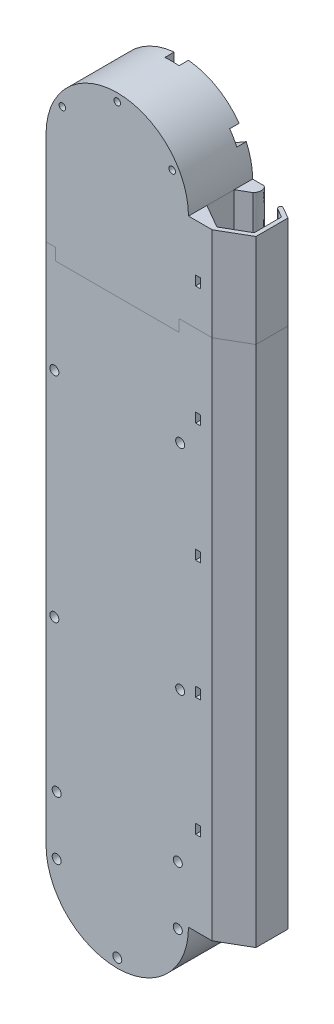
from build123d import *

# Parameters (mm, degrees)
BOSS_EXTRUDE1_DEPTH    = 25
CUT_EXTRUDE2_DEPTH     = 6
SKETCH5_R              = 1.9
SKETCH5_R_2            = 1.4
CUT_EXTRUDE4_DEPTH     = 165.405261473
CUT_EXTRUDE3_START     = -2
CUT_EXTRUDE3_DEPTH     = 4
SKETCH12_R             = 1.9
SKETCH12_R_2           = 1.4
BOSS_EXTRUDE2_DEPTH    = 2
BOSS_EXTRUDE3_START    = 129.7
BOSS_EXTRUDE3_DEPTH    = 259.4
CUT_EXTRUDE5_DEPTH     = 296.210345526
CUT_EXTRUDE6_REACH     = 172.003
SKETCH15_W             = 2
SKETCH15_H             = 4
SKETCH19_R             = 3
SKETCH19_W             = 6
SKETCH19_H             = 14.760042768
CUT_EXTRUDE9_DEPTH     = 4
CUT_EXTRUDE10_REACH    = 183.383
SKETCH20_R             = 1.5
SPLIT2_SURFACE_1_BACK  = 331.775
SPLIT2_SURFACE_1_DEPTH = 663.55
SPLIT2_SURFACE_2_BACK  = 331.775
SPLIT2_SURFACE_2_DEPTH = 663.55


with BuildPart() as part:
    # Sketch1 → Boss-Extrude1 (new body)
    with BuildSketch(Plane.XY):
        with BuildLine():
            Line((-30, -129.7), (-30, 129.7))
            ThreePointArc((-30, 129.7), (0, 159.7), (30, 129.7))
            Line((30, 129.7), (30, -129.7))
            ThreePointArc((30, -129.7), (0, -159.7), (-30, -129.7))
        make_face()
        with BuildLine():
            Line((-22, -129.7), (-22, 129.7))
            ThreePointArc((-22, 129.7), (0, 151.7), (22, 129.7))
            Line((22, 129.7), (22, -129.7))
            ThreePointArc((22, -129.7), (0, -151.7), (-22, -129.7))
        make_face(mode=Mode.SUBTRACT)
    extrude(amount=BOSS_EXTRUDE1_DEPTH)

    # Sketch9 → Cut-Extrude2 (cut)
    with BuildSketch(Plane.XY):
        Polygon((-21.390212729, -156.804138466), (-12.197628205, -143.163529172), (11.525170568, -143.163529172), (24.276174908, -155.914533512), (43.106146434, -137.084561987), (43.106146434, -85.339207165), (-47.337023886, -85.339207165), (-47.337023886, -133.377874679), align=None)
    extrude(amount=CUT_EXTRUDE2_DEPTH, mode=Mode.SUBTRACT)

    # Sketch5 → Cut-Extrude4 (cut, through all)
    with BuildSketch(Plane.XY):
        with Locations((0, -155.8)):
            Circle(SKETCH5_R)
        with Locations((26.5, -44.8)):
            Circle(SKETCH5_R)
        with Locations((26.5, 45.2)):
            Circle(SKETCH5_R)
        with Locations((-26.5, 45.2)):
            Circle(SKETCH5_R)
        with Locations((-26.5, -44.8)):
            Circle(SKETCH5_R)
        with Locations((0, 156.4)):
            Circle(SKETCH5_R_2)
        with Locations((-23.122878281, 143.05)):
            Circle(SKETCH5_R_2)
        with Locations((-23.122878281, 116.35)):
            Circle(SKETCH5_R_2)
        with Locations((23.122878281, 116.35)):
            Circle(SKETCH5_R_2)
        with Locations((25.5, -108.05)):
            Circle(SKETCH5_R)
        with Locations((25.5, -132.55)):
            Circle(SKETCH5_R)
        with Locations((-25.5, -132.55)):
            Circle(SKETCH5_R)
        with Locations((-25.5, -108.05)):
            Circle(SKETCH5_R)
        with Locations((23.122878281, 143.05)):
            Circle(SKETCH5_R_2)
    extrude(amount=CUT_EXTRUDE4_DEPTH, mode=Mode.SUBTRACT)

    # Sketch10 → Cut-Extrude3 (cut)
    with BuildSketch(Plane(origin=(0, 0, 0), x_dir=(-1, 0, 0), z_dir=(0, 0, -1)).offset(CUT_EXTRUDE3_START)):
        Polygon((-3.6, -157.878460969), (-3.6, -162.71716658), (3.6, -162.71716658), (3.6, -157.878460969), (3.6, -153.721539031), (0, -151.643078062), (-3.6, -153.721539031), align=None)
        Polygon((24.421539031, -48.4), (16.2024551, -53.14529032), (16.2024551, -37.249607228), (24.421539031, -41.2), (28.578460969, -41.2), (30.656921938, -44.8), (28.578460969, -48.4), align=None)
        Polygon((-30.656921938, -44.8), (-28.578460969, -48.4), (-24.421539031, -48.4), (-20.400603584, -51.424934988), (-19.526426192, -39.273869232), (-24.421539031, -41.2), (-28.578460969, -41.2), align=None)
        Polygon((-30.656921938, 45.2), (-28.578460969, 41.6), (-24.421539031, 41.6), (-19.065060642, 37.994104383), (-19.065060642, 53.102628113), (-24.421539031, 48.8), (-28.578460969, 48.8), align=None)
        Polygon((30.656921938, 45.2), (28.578460969, 48.8), (24.421539031, 48.8), (16.2024551, 49.307061606), (16.66355995, 39.520928689), (24.421539031, 41.6), (28.578460969, 41.6), align=None)
    extrude(amount=-CUT_EXTRUDE3_DEPTH, mode=Mode.SUBTRACT)

    # Sketch12 → Boss-Extrude2 (add)
    with BuildSketch(Plane.XY.offset(25)):
        with BuildLine():
            ThreePointArc((-30, -129.7), (0, -159.7), (30, -129.7))
            Line((30, -129.7), (30, 129.7))
            ThreePointArc((30, 129.7), (0, 159.7), (-30, 129.7))
            Line((-30, 129.7), (-30, -129.7))
        make_face()
        with Locations((-25.5, -132.55)):
            Circle(SKETCH12_R, mode=Mode.SUBTRACT)
        with Locations((-25.5, -108.05)):
            Circle(SKETCH12_R, mode=Mode.SUBTRACT)
        with Locations((-26.5, -44.8)):
            Circle(SKETCH12_R, mode=Mode.SUBTRACT)
        with Locations((0, -155.8)):
            Circle(SKETCH12_R, mode=Mode.SUBTRACT)
        with Locations((25.5, -132.55)):
            Circle(SKETCH12_R, mode=Mode.SUBTRACT)
        with Locations((25.5, -108.05)):
            Circle(SKETCH12_R, mode=Mode.SUBTRACT)
        with Locations(Location((26.5, -44.8, 0), (0, 0, 180))):
            Circle(SKETCH12_R, mode=Mode.SUBTRACT)
        with Locations(Location((-26.5, 45.2, 0), (0, 0, 180))):
            Circle(SKETCH12_R, mode=Mode.SUBTRACT)
        with Locations((-23.122878281, 143.05)):
            Circle(SKETCH12_R_2, mode=Mode.SUBTRACT)
        with Locations((0, 156.4)):
            Circle(SKETCH12_R_2, mode=Mode.SUBTRACT)
        with Locations((23.122878281, 143.05)):
            Circle(SKETCH12_R_2, mode=Mode.SUBTRACT)
        with Locations((26.5, 45.2)):
            Circle(SKETCH12_R, mode=Mode.SUBTRACT)
    extrude(amount=BOSS_EXTRUDE2_DEPTH)

    # Sketch13 → Boss-Extrude3 (add)
    with BuildSketch(Plane(origin=(0, 0, 0), x_dir=(1, 0, 0), z_dir=(0, 1, 0)).offset(BOSS_EXTRUDE3_START)):
        Polygon((30, -5.75), (39.959292144, 0), (30, 0), align=None)
        Polygon((51.650635095, -20.25), (51.650635095, -6.75), (39.959292144, 0), (30, -5.75), (30, -7.75), (39.959292144, -2), (49.918584287, -7.75), (49.918584287, -19.25), (39.959292144, -25), (30, -19.25), (30, -21.25), (39.959292144, -27), align=None)
        Polygon((30, -27), (39.959292144, -27), (30, -21.25), align=None)
    extrude(amount=-BOSS_EXTRUDE3_DEPTH)

    # Sketch14 → Cut-Extrude5 (cut, through all)
    with BuildSketch(Plane(origin=(0, 129.7, 0), x_dir=(1, 0, 0), z_dir=(0, 1, 0))):
        with BuildLine():
            Line((34.753614704, 0), (41.389978142, 4.813813584))
            Line((41.389978142, 4.813813584), (46.705528738, -3.894941514))
            add(Edge.make_bspline(
                [(46.219489402, -5.614326572), (45.136522269, -4.989075207), (45.751856574, -3.48025056), (46.705528738, -3.894941514)],
                knots=[0, 0, 0, 0, 1, 1, 1, 1], degree=3))
            Line((46.219489402, -5.614326572), (34.124720843, -5.368591311))
            add(Edge.make_bspline(
                [(34.124720843, -5.368591311), (36.321189715, -4.695693649), (36.745862601, -0.785774314), (34.753614704, 0)],
                knots=[0, 0, 0, 0, 1, 1, 1, 1], degree=3))
        make_face()
    extrude(amount=-CUT_EXTRUDE5_DEPTH, mode=Mode.SUBTRACT)

    # Cut-Extrude6: up to this plane
    cut_extrude6_end = Plane(origin=(-0.835494511, -129.7, 1.447118943), z_dir=(-0.5000000000000001, 0, 0.8660254037844386))
    # Sketch15 → Cut-Extrude6 (cut, up to the surface)
    with BuildSketch(Plane.XY.offset(27), mode=Mode.PRIVATE) as cut_extrude6_sk1:
        with Locations((33.996498591, 57.7)):
            Rectangle(SKETCH15_W, SKETCH15_H)
    cut_extrude6_tool1 = split(extrude(cut_extrude6_sk1.sketch, amount=-CUT_EXTRUDE6_REACH, mode=Mode.PRIVATE), bisect_by=cut_extrude6_end, keep=Keep.BOTH, mode=Mode.PRIVATE)
    add(cut_extrude6_tool1.solids().sort_by_distance((33.996499, 57.7, 27))[0], mode=Mode.SUBTRACT)
    # Sketch15 → Cut-Extrude6 (cut, up to the surface)
    with BuildSketch(Plane.XY.offset(27), mode=Mode.PRIVATE) as cut_extrude6_sk2:
        with Locations((33.996498591, 107.7)):
            Rectangle(SKETCH15_W, SKETCH15_H)
    cut_extrude6_tool2 = split(extrude(cut_extrude6_sk2.sketch, amount=-CUT_EXTRUDE6_REACH, mode=Mode.PRIVATE), bisect_by=cut_extrude6_end, keep=Keep.BOTH, mode=Mode.PRIVATE)
    add(cut_extrude6_tool2.solids().sort_by_distance((33.996499, 107.7, 27))[0], mode=Mode.SUBTRACT)
    # Sketch15 → Cut-Extrude6 (cut, up to the surface)
    with BuildSketch(Plane.XY.offset(27), mode=Mode.PRIVATE) as cut_extrude6_sk3:
        with Locations((33.996498591, 7.7)):
            Rectangle(SKETCH15_W, SKETCH15_H)
    cut_extrude6_tool3 = split(extrude(cut_extrude6_sk3.sketch, amount=-CUT_EXTRUDE6_REACH, mode=Mode.PRIVATE), bisect_by=cut_extrude6_end, keep=Keep.BOTH, mode=Mode.PRIVATE)
    add(cut_extrude6_tool3.solids().sort_by_distance((33.996499, 7.7, 27))[0], mode=Mode.SUBTRACT)
    # Sketch15 → Cut-Extrude6 (cut, up to the surface)
    with BuildSketch(Plane.XY.offset(27), mode=Mode.PRIVATE) as cut_extrude6_sk4:
        with Locations((33.996498591, -42.3)):
            Rectangle(SKETCH15_W, SKETCH15_H)
    cut_extrude6_tool4 = split(extrude(cut_extrude6_sk4.sketch, amount=-CUT_EXTRUDE6_REACH, mode=Mode.PRIVATE), bisect_by=cut_extrude6_end, keep=Keep.BOTH, mode=Mode.PRIVATE)
    add(cut_extrude6_tool4.solids().sort_by_distance((33.996499, -42.3, 27))[0], mode=Mode.SUBTRACT)
    # Sketch15 → Cut-Extrude6 (cut, up to the surface)
    with BuildSketch(Plane.XY.offset(27), mode=Mode.PRIVATE) as cut_extrude6_sk5:
        with Locations((33.996498591, -92.3)):
            Rectangle(SKETCH15_W, SKETCH15_H)
    cut_extrude6_tool5 = split(extrude(cut_extrude6_sk5.sketch, amount=-CUT_EXTRUDE6_REACH, mode=Mode.PRIVATE), bisect_by=cut_extrude6_end, keep=Keep.BOTH, mode=Mode.PRIVATE)
    add(cut_extrude6_tool5.solids().sort_by_distance((33.996499, -92.3, 27))[0], mode=Mode.SUBTRACT)

    # Sketch19 → Cut-Extrude9 (cut)
    with BuildSketch(Plane(origin=(0, 0, 0), x_dir=(-1, 0, 0), z_dir=(0, 0, -1))):
        with Locations((-23.122878281, 116.35)):
            Circle(SKETCH19_R)
        with Locations((23.122878281, 116.35)):
            Circle(SKETCH19_R)
        Polygon((18.231592282, 136.761913097), (31.01416428, 144.141934481), (28.01416428, 149.338086903), (15.231592282, 141.958065519), align=None)
        with Locations((0, 156.4)):
            Rectangle(SKETCH19_W, SKETCH19_H)
        Polygon((-15.231592282, 141.958065519), (-28.01416428, 149.338086903), (-31.01416428, 144.141934481), (-18.231592282, 136.761913097), align=None)
    extrude(amount=-CUT_EXTRUDE9_DEPTH, mode=Mode.SUBTRACT)

    # Cut-Extrude10: up to this face of the body (flat: up to its plane)
    cut_extrude10_end = Plane(part.part.faces().sort_by_distance((30, 0, 13.5))[0])
    # Sketch20 → Cut-Extrude10 (cut, up to the picked face)
    with BuildSketch(Plane.ZY.offset(30), mode=Mode.PRIVATE) as cut_extrude10_sk1:
        with Locations(Location((20.5, 87.8, 0), (0, 0, 213.557309762))):
            Circle(SKETCH20_R)
    cut_extrude10_tool1 = split(extrude(cut_extrude10_sk1.sketch, amount=-CUT_EXTRUDE10_REACH, mode=Mode.PRIVATE), bisect_by=cut_extrude10_end, keep=Keep.BOTH, mode=Mode.PRIVATE)
    # Sketch20 → Cut-Extrude10 (cut, up to the picked face)
    with BuildSketch(Plane.ZY.offset(30), mode=Mode.PRIVATE) as cut_extrude10_sk2:
        with Locations(Location((4.5, 87.8, 0), (0, 0, 270))):
            Circle(SKETCH20_R)
    cut_extrude10_tool2 = split(extrude(cut_extrude10_sk2.sketch, amount=-CUT_EXTRUDE10_REACH, mode=Mode.PRIVATE), bisect_by=cut_extrude10_end, keep=Keep.BOTH, mode=Mode.PRIVATE)
    add(cut_extrude10_tool1.solids().sort_by(Axis((-30, 87.8, 20.5), (1, 0, 0)))[0], mode=Mode.SUBTRACT)
    add(cut_extrude10_tool2.solids().sort_by(Axis((-30, 87.8, 4.5), (1, 0, 0)))[0], mode=Mode.SUBTRACT)


with BuildPart() as body_2:
    # Split2: the piece behind the surface
    add(part.part)
    # Split2 surface: a surface, the sketch's curves swept straight by 663.55 mm
    with BuildLine(Plane.XY.offset(27).offset(-SPLIT2_SURFACE_1_BACK), mode=Mode.PRIVATE) as split2_surface_1_path:
        Line((-56.581540955, 90.3), (-26, 90.3))
        Line((-26, 90.3), (-26, 85.3))
        Line((-26, 85.3), (-0.354937424, 85.3))
        Line((-0.354937424, 85.3), (26, 85.3))
        Line((26, 85.3), (26, 90.3))
        Line((26, 90.3), (80.735305882, 90.3))
        Line((80.735305882, 90.3), (80.735305882, 186.789410698))
        Line((80.735305882, 186.789410698), (-47.830309584, 186.789410698))
        Line((-47.830309584, 186.789410698), (-56.581540955, 90.3))
    split2_surface_1 = Shell.extrude(split2_surface_1_path.wire(), (0 * SPLIT2_SURFACE_1_DEPTH, 0 * SPLIT2_SURFACE_1_DEPTH, 1 * SPLIT2_SURFACE_1_DEPTH))
    split(bisect_by=split2_surface_1, keep=Keep.BOTTOM)


with BuildPart() as part_1:
    add(part.part)

    # Split2: split by a surface, the side it looks to stays
    # Split2 surface: a surface, the sketch's curves swept straight by 663.55 mm
    with BuildLine(Plane.XY.offset(27).offset(-SPLIT2_SURFACE_2_BACK), mode=Mode.PRIVATE) as split2_surface_2_path:
        Line((-56.581540955, 90.3), (-26, 90.3))
        Line((-26, 90.3), (-26, 85.3))
        Line((-26, 85.3), (-0.354937424, 85.3))
        Line((-0.354937424, 85.3), (26, 85.3))
        Line((26, 85.3), (26, 90.3))
        Line((26, 90.3), (80.735305882, 90.3))
        Line((80.735305882, 90.3), (80.735305882, 186.789410698))
        Line((80.735305882, 186.789410698), (-47.830309584, 186.789410698))
        Line((-47.830309584, 186.789410698), (-56.581540955, 90.3))
    split2_surface_2 = Shell.extrude(split2_surface_2_path.wire(), (0 * SPLIT2_SURFACE_2_DEPTH, 0 * SPLIT2_SURFACE_2_DEPTH, 1 * SPLIT2_SURFACE_2_DEPTH))
    split(bisect_by=split2_surface_2, keep=Keep.TOP)


solid = Compound([body_2.part, part_1.part])
